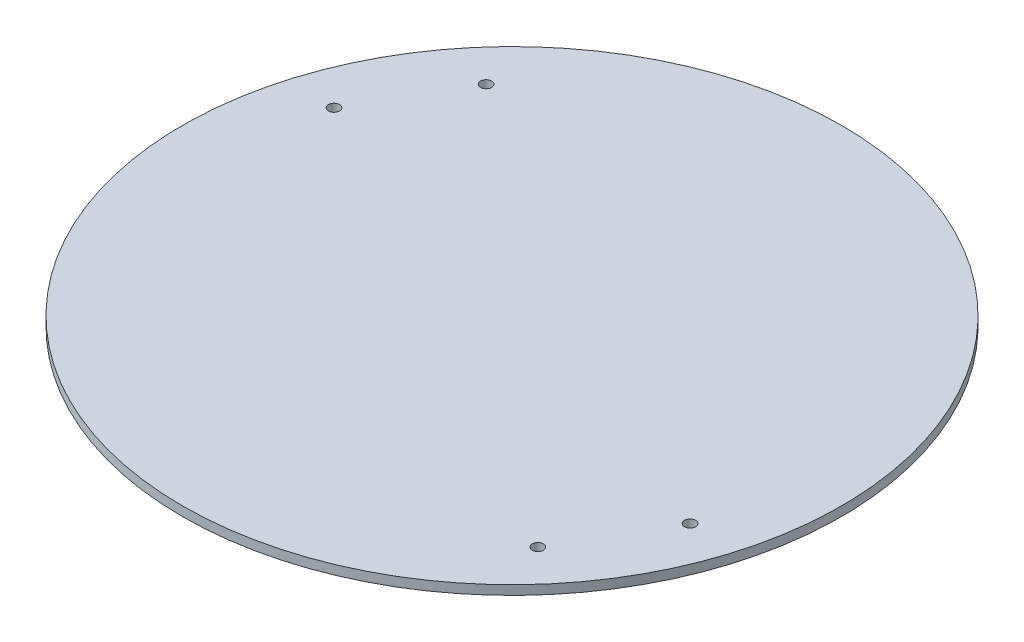
from build123d import *

# Parameters (mm, degrees)
SKETCH_1_R      = 177.5
SKETCH_1_R_2    = 3
EXTRUDE_1_DEPTH = 5


with BuildPart() as part:
    # 草图1 → 凸台-拉伸1 (new body)
    with BuildSketch(Plane(origin=(0, 0, 0), x_dir=(1, 0, 0), z_dir=(0, 1, 0))):
        with Locations(Location((135.338999709, -117.383106, 0), (0, 0, 270))):
            Circle(SKETCH_1_R)
        with Locations(Location((20.435189142, -16.402343887, 0), (0, 0, 270))):
            Circle(SKETCH_1_R_2, mode=Mode.SUBTRACT)
        with Locations(Location((-9.564810858, -68.363868114, 0), (0, 0, 270))):
            Circle(SKETCH_1_R_2, mode=Mode.SUBTRACT)
        with Locations(Location((250.242810277, -218.363868114, 0), (0, 0, 270))):
            Circle(SKETCH_1_R_2, mode=Mode.SUBTRACT)
        with Locations(Location((280.242810277, -166.402343887, 0), (0, 0, 270))):
            Circle(SKETCH_1_R_2, mode=Mode.SUBTRACT)
    extrude(amount=EXTRUDE_1_DEPTH)


solid = part.part
